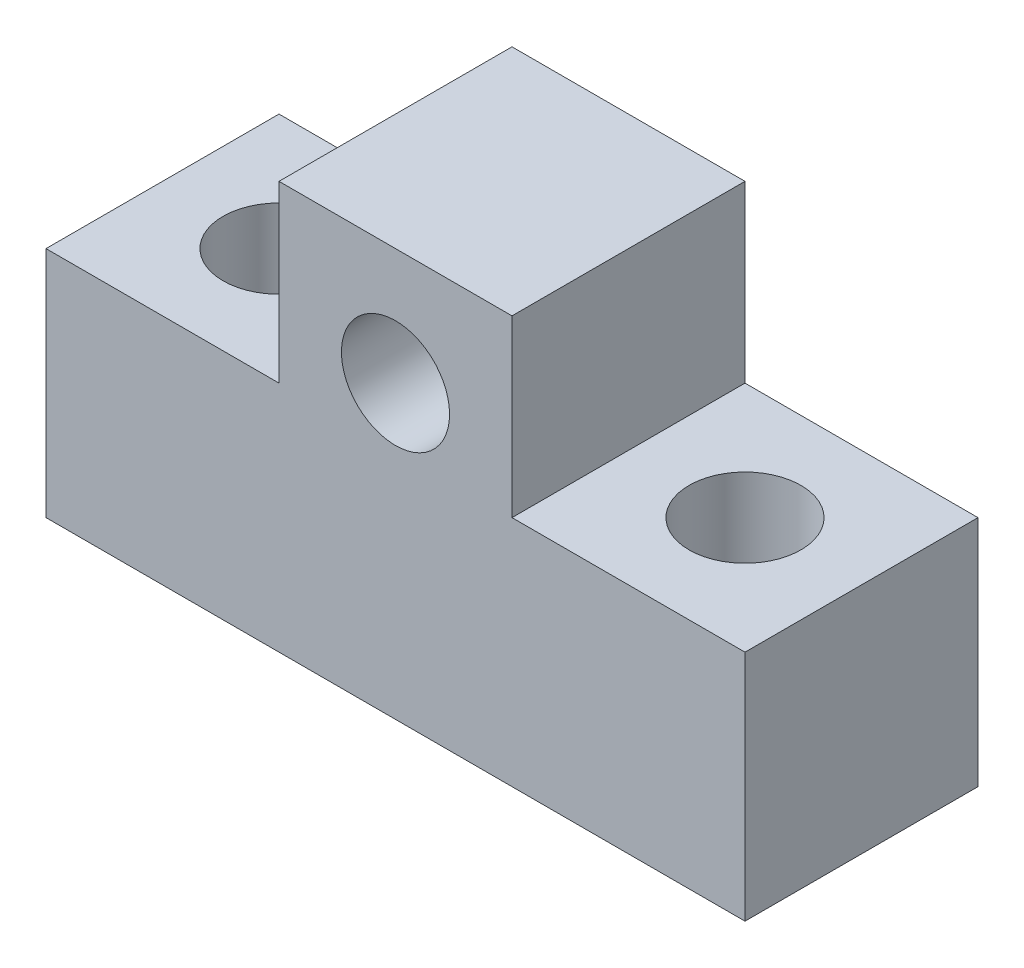
from build123d import *

# Parameters (mm, degrees)
SKETCH1_W                        = 19.05
SKETCH1_H                        = 6.35
BOSS_EXTRUDE1_DEPTH              = 6.35
SKETCH6_W                        = 6.35
SKETCH6_H                        = 6.35
BOSS_EXTRUDE2_DEPTH              = 4.7625
TAPPED_HOLE_FOR_4_40_HELICOIL1_D = 3.048
F_4_CLEARANCE_HOLE2_D            = 2.9464


with BuildPart() as part:
    # Sketch1 → Boss-Extrude1 (new body)
    with BuildSketch(Plane.XY):
        Rectangle(SKETCH1_W, SKETCH1_H)
    extrude(amount=BOSS_EXTRUDE1_DEPTH)

    # Sketch6 → Boss-Extrude2 (add)
    with BuildSketch(Plane(origin=(0, 3.175, 0), x_dir=(1, 0, 0), z_dir=(0, 1, 0))):
        with Locations((0, -3.175)):
            Rectangle(SKETCH6_W, SKETCH6_H)
    extrude(amount=BOSS_EXTRUDE2_DEPTH)

    # Tapped Hole for #4-40 Helicoil1 (through all)
    with Locations(Plane(origin=(0, 3.175, 0), x_dir=(1, 0, 0), z_dir=(0, 1, 0))):
        with Locations((-6.35, -3.175), (6.35, -3.175)):
            Hole(TAPPED_HOLE_FOR_4_40_HELICOIL1_D / 2)

    # #4 Clearance Hole2 (through all)
    with Locations(Plane.XY.offset(6.35)):
        with Locations((0, 4.7625)):
            Hole(F_4_CLEARANCE_HOLE2_D / 2)


solid = part.part
